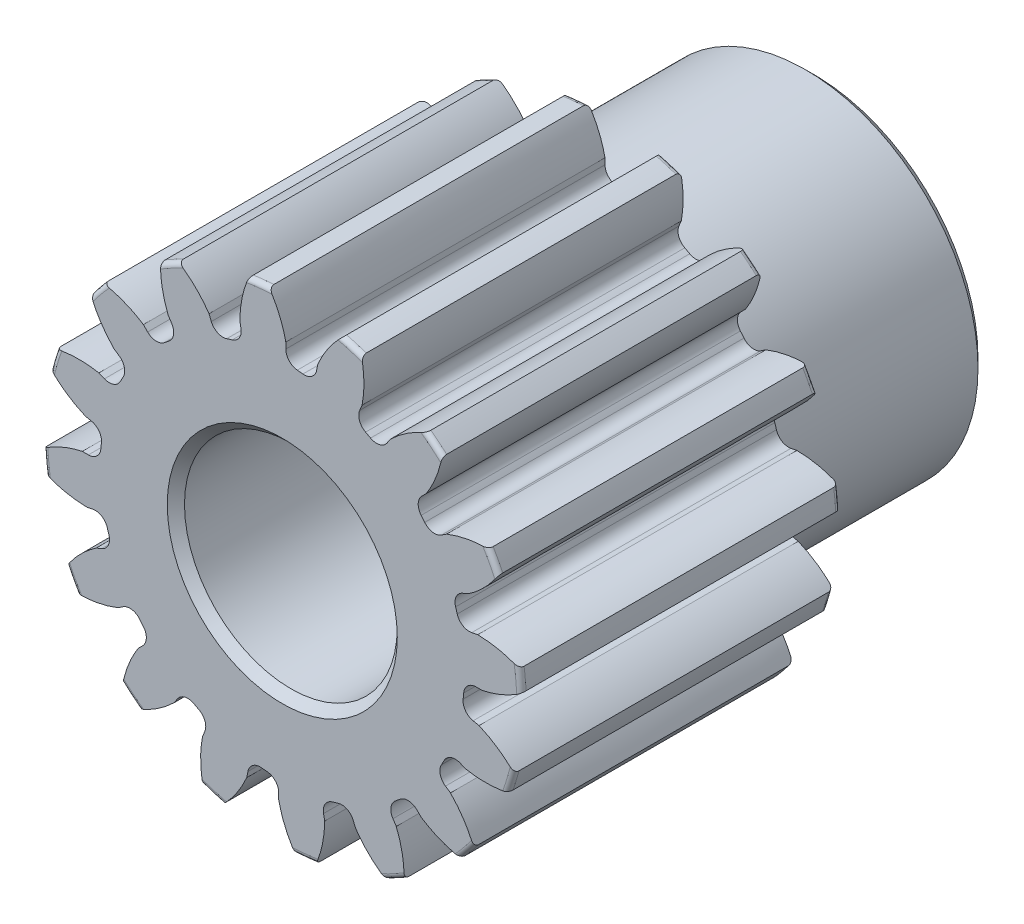
from build123d import *

# Parameters (mm, degrees)
SKETCH1_R                = 14.2875
BOSS_EXTRUDE1_DEPTH      = 19.05
SKETCH2_W                = 12.7
SKETCH2_H                = 10.287
FILLET2_R                = 0.28575
CUT_EXTRUDE1_DEPTH       = 38.634130952
FILLET1_R                = 0.7480935
CIRPATTERN1_COUNT        = 16
FILLET1_OF_CIRPATTERN1_R = 0.7480935
SKETCH5_R                = 6.35
CUT_EXTRUDE2_DEPTH       = 38.617471243
CHAMFER1_SIZE            = 0.51435


with BuildPart() as part:
    # Sketch1 → Boss-Extrude1 (new body)
    with BuildSketch(Plane.XY):
        Circle(SKETCH1_R)
    extrude(amount=-BOSS_EXTRUDE1_DEPTH)

    # Sketch2 → Revolve1 (revolve)
    with BuildSketch(Plane(origin=(0, 0, 0), x_dir=(0, 0, -1), z_dir=(1, 0, 0)), mode=Mode.PRIVATE) as revolve1_sk:
        with Locations((25.4, 5.1435)):
            Rectangle(SKETCH2_W, SKETCH2_H)
    revolve(revolve1_sk.sketch.rotate(Axis((0, 0, -19.05), (0, 0, -1)), 90), axis=Axis((0, 0, -19.05), (0, 0, -1)))

    # Fillet2
    fillet2_edges = [part.edges().sort_by_distance(p)[0] for p in [
        (-14.2875, 0, 0),
        (-14.2875, 0, -19.05),
        (-10.287, 0, -19.05),
    ]]
    fillet(fillet2_edges, radius=FILLET2_R)

    # Sketch4 → Cut-Extrude1 (cut, through all)
    with BuildSketch(Plane.XY):
        with BuildLine():
            Line((0.210823499, 11.932233972), (0.210823499, 10.86121658))
            ThreePointArc((0.210823499, 10.86121658), (1.064788407, 10.810952677), (1.912150566, 10.693650095))
            Line((1.912150566, 10.693650095), (2.121096176, 11.744088093))
            add(Edge.make_bspline(
                [(6.521003735, 15.575091257), (3.285842325, 14.461099148), (2.121096176, 11.744088093)],
                knots=[0, 0, 0, 1, 1, 1], degree=2))
            ThreePointArc((6.521003735, 15.575091257), (1.655034105, 16.803803721), (-3.35714731, 16.548006506))
            add(Edge.make_bspline(
                [(-3.35714731, 16.548006506), (-0.40147849, 14.824269404), (0.210823499, 11.932233972)],
                knots=[0, 0, 0, 1, 1, 1], degree=2))
        make_face()
    cut_extrude1 = extrude(amount=-CUT_EXTRUDE1_DEPTH, mode=Mode.SUBTRACT)

    # Fillet1
    fillet1_edges = [part.edges().sort_by_distance(p)[0] for p in [
        (1.912150566, 10.693650095, -9.525),
        (0.210823499, 10.86121658, -9.525),
    ]]
    fillet(fillet1_edges, radius=FILLET1_R)

    # CirPattern1: Cut-Extrude1 ×16 about axis
    cirpattern1_axis = Axis((0, 0, -19.05), (0, 0, 1))
    for i in range(1, CIRPATTERN1_COUNT):
        add(cut_extrude1.rotate(cirpattern1_axis, i * 360 / CIRPATTERN1_COUNT), mode=Mode.SUBTRACT)

    # Fillet1 of CirPattern1
    fillet1_of_cirpattern1_edges = [part.edges().sort_by_distance(p)[0] for p in [
        (-2.325685952, 10.611392792, -9.525),
        (-3.961632125, 10.115134357, -9.525),
        (-6.209457866, 8.91364713, -9.525),
        (-7.53096517, 7.829114621, -9.525),
        (-9.147896109, 5.858879494, -9.525),
        (-9.953777036, 4.351183156, -9.525),
        (-10.693650095, 1.912150566, -9.525),
        (-10.86121658, 0.210823499, -9.525),
        (-10.611392792, -2.325685952, -9.525),
        (-10.115134357, -3.961632125, -9.525),
        (-8.91364713, -6.209457866, -9.525),
        (-7.829114621, -7.53096517, -9.525),
        (-5.858879494, -9.147896109, -9.525),
        (-4.351183156, -9.953777036, -9.525),
        (-1.912150566, -10.693650095, -9.525),
        (-0.210823499, -10.86121658, -9.525),
        (2.325685952, -10.611392792, -9.525),
        (3.961632125, -10.115134357, -9.525),
        (6.209457866, -8.91364713, -9.525),
        (7.53096517, -7.829114621, -9.525),
        (9.147896109, -5.858879494, -9.525),
        (9.953777036, -4.351183156, -9.525),
        (10.693650095, -1.912150566, -9.525),
        (10.86121658, -0.210823499, -9.525),
        (10.611392792, 2.325685952, -9.525),
        (10.115134357, 3.961632125, -9.525),
        (8.91364713, 6.209457866, -9.525),
        (7.829114621, 7.53096517, -9.525),
        (5.858879494, 9.147896109, -9.525),
        (4.351183156, 9.953777036, -9.525),
    ]]
    fillet(fillet1_of_cirpattern1_edges, radius=FILLET1_OF_CIRPATTERN1_R)

    # Sketch5 → Cut-Extrude2 (cut, through all)
    with BuildSketch(Plane.XY):
        Circle(SKETCH5_R)
    extrude(amount=-CUT_EXTRUDE2_DEPTH, mode=Mode.SUBTRACT)

    # Chamfer1
    chamfer1_edges = [part.edges().sort_by_distance(p)[0] for p in [
        (-10.287, 0, -31.75),
        (-6.35, 0, -31.75),
        (-6.35, 0, 0),
    ]]
    chamfer(chamfer1_edges, length=CHAMFER1_SIZE)


solid = part.part
